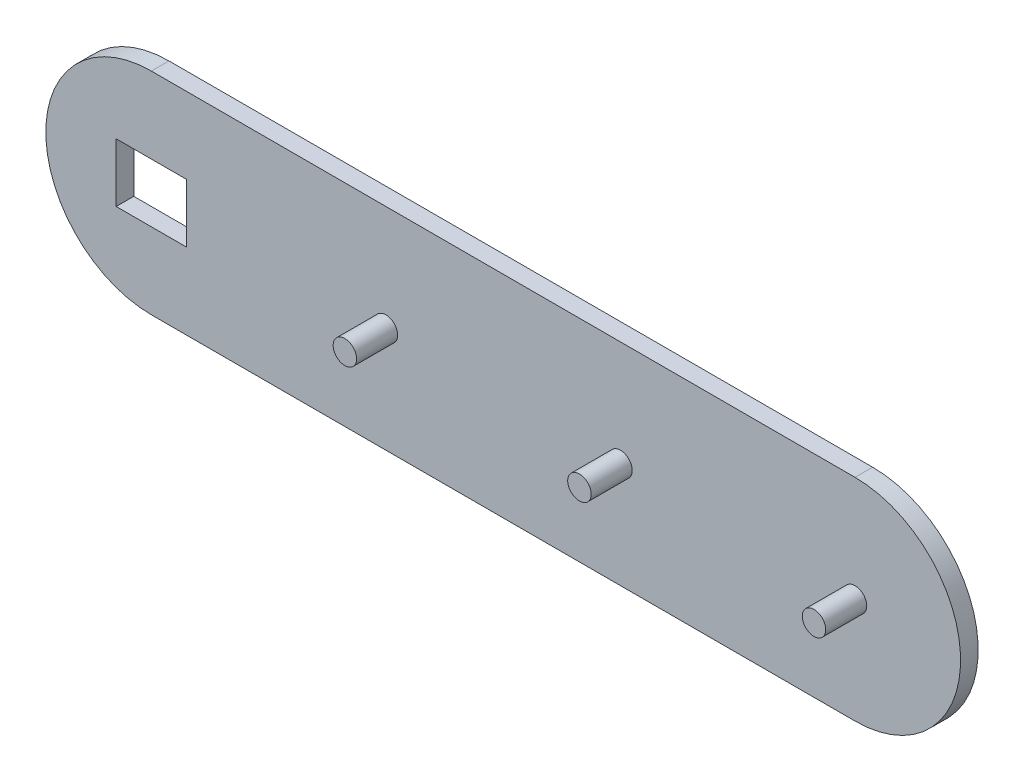
from build123d import *

# Parameters (mm, degrees)
BOSS_EXTRUDE1_DEPTH = 3
SKETCH3_W           = 12
SKETCH3_H           = 10
CUT_EXTRUDE1_DEPTH  = 3
SKETCH5_R           = 2
BOSS_EXTRUDE2_DEPTH = 7
LPATTERN1_COUNT     = 4
LPATTERN1_PITCH     = 40


with BuildPart() as part:
    # Sketch2 → Boss-Extrude1 (new body)
    with BuildSketch(Plane.XY):
        with BuildLine():
            Line((0, 18), (120, 18))
            ThreePointArc((120, 18), (138, 0), (120, -18))
            Line((120, -18), (0, -18))
            ThreePointArc((0, -18), (-18, 0), (0, 18))
        make_face()
    extrude(amount=BOSS_EXTRUDE1_DEPTH)

    # Sketch3 → Cut-Extrude1 (cut)
    with BuildSketch(Plane.XY.offset(3)):
        Rectangle(SKETCH3_W, SKETCH3_H)
    extrude(amount=-CUT_EXTRUDE1_DEPTH, mode=Mode.SUBTRACT)

    # Sketch5 → Boss-Extrude2 (add)
    with BuildSketch(Plane.XY.offset(3)):
        with Locations((120, 0)):
            Circle(SKETCH5_R)
    boss_extrude2 = extrude(amount=BOSS_EXTRUDE2_DEPTH)

    # LPattern1: Boss-Extrude2 ×4, 1 skipped
    with Locations(*[(-i * LPATTERN1_PITCH, 0, 0) for i in range(1, LPATTERN1_COUNT) if i not in (3,)]):
        add(boss_extrude2)


solid = part.part
